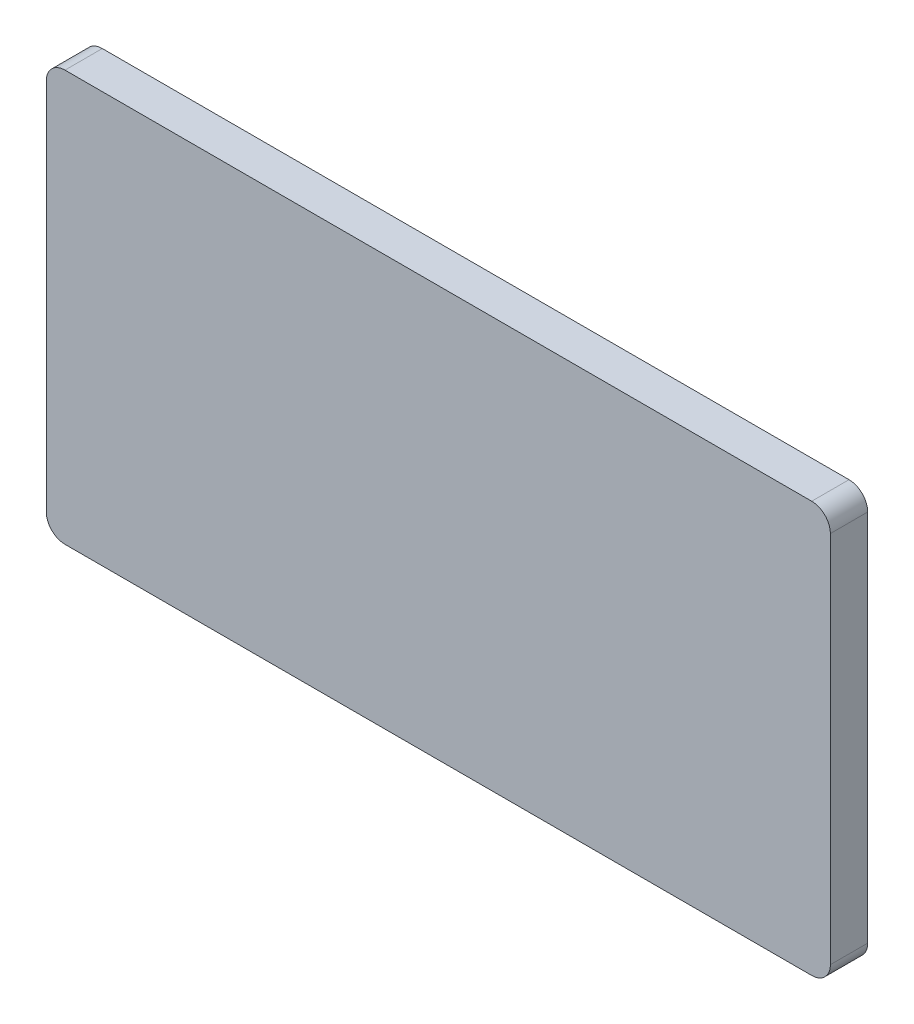
from build123d import *

# Parameters (mm, degrees)
SALIENTE_EXTRUIR1_DEPTH = 5


with BuildPart() as part:
    # Croquis1 → Saliente-Extruir1 (new body)
    with BuildSketch(Plane.XY):
        with BuildLine():
            Line((-41.394645941, 28.104490501), (58.605354059, 28.104490501))
            ThreePointArc((58.605354059, 28.104490501), (60.373121012, 27.372257454), (61.105354059, 25.604490501))
            Line((61.105354059, 25.604490501), (61.105354059, -24.395509499))
            ThreePointArc((61.105354059, -24.395509499), (60.373121012, -26.163276452), (58.605354059, -26.895509499))
            Line((58.605354059, -26.895509499), (-41.394645941, -26.895509499))
            ThreePointArc((-41.394645941, -26.895509499), (-43.162412894, -26.163276452), (-43.894645941, -24.395509499))
            Line((-43.894645941, -24.395509499), (-43.894645941, 25.604490501))
            ThreePointArc((-43.894645941, 25.604490501), (-43.162412894, 27.372257454), (-41.394645941, 28.104490501))
        make_face()
    extrude(amount=SALIENTE_EXTRUIR1_DEPTH)


solid = part.part
